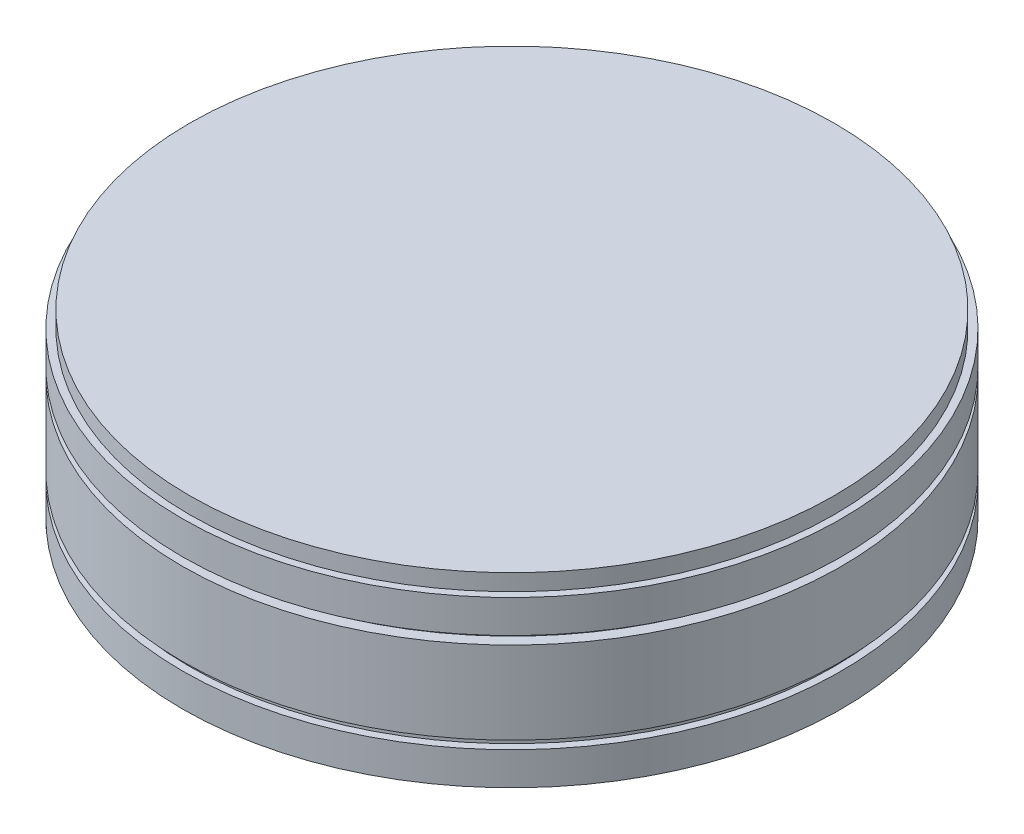
from build123d import *

# Parameters (mm, degrees)
SKETCH1_R           = 20
BOSS_EXTRUDE1_DEPTH = 2
SKETCH2_R           = 19.549486802
BOSS_EXTRUDE2_DEPTH = 0.5
SKETCH3_R           = 20
BOSS_EXTRUDE3_DEPTH = 5
SKETCH4_R           = 19.338248166
BOSS_EXTRUDE4_DEPTH = 0.5
SKETCH5_R           = 20
BOSS_EXTRUDE5_DEPTH = 2
SKETCH6_R           = 19.569190597
BOSS_EXTRUDE6_DEPTH = 1


with BuildPart() as part:
    # Sketch1 → Boss-Extrude1 (new body)
    with BuildSketch(Plane(origin=(0, 0, 0), x_dir=(1, 0, 0), z_dir=(0, 1, 0))):
        with Locations(Location((0, 0, 0), (0, 0, 270))):
            Circle(SKETCH1_R)
    extrude(amount=BOSS_EXTRUDE1_DEPTH)

    # Sketch2 → Boss-Extrude2 (add)
    with BuildSketch(Plane(origin=(0, 2, 0), x_dir=(1, 0, 0), z_dir=(0, 1, 0))):
        with Locations(Location((0, 0, 0), (0, 0, 270))):
            Circle(SKETCH2_R)
    extrude(amount=BOSS_EXTRUDE2_DEPTH)

    # Sketch3 → Boss-Extrude3 (add)
    with BuildSketch(Plane(origin=(0, 2.5, 0), x_dir=(1, 0, 0), z_dir=(0, 1, 0))):
        with Locations(Location((0, 0, 0), (0, 0, 270))):
            Circle(SKETCH3_R)
    extrude(amount=BOSS_EXTRUDE3_DEPTH)

    # Sketch4 → Boss-Extrude4 (add)
    with BuildSketch(Plane(origin=(0, 7.5, 0), x_dir=(1, 0, 0), z_dir=(0, 1, 0))):
        with Locations(Location((0, 0, 0), (0, 0, 270))):
            Circle(SKETCH4_R)
    extrude(amount=BOSS_EXTRUDE4_DEPTH)

    # Sketch5 → Boss-Extrude5 (add)
    with BuildSketch(Plane(origin=(0, 8, 0), x_dir=(1, 0, 0), z_dir=(0, 1, 0))):
        with Locations(Location((0, 0, 0), (0, 0, 270))):
            Circle(SKETCH5_R)
    extrude(amount=BOSS_EXTRUDE5_DEPTH)

    # Sketch6 → Boss-Extrude6 (add)
    with BuildSketch(Plane(origin=(0, 10, 0), x_dir=(1, 0, 0), z_dir=(0, 1, 0))):
        with Locations(Location((0, 0, 0), (0, 0, 270))):
            Circle(SKETCH6_R)
    extrude(amount=BOSS_EXTRUDE6_DEPTH)


solid = part.part
